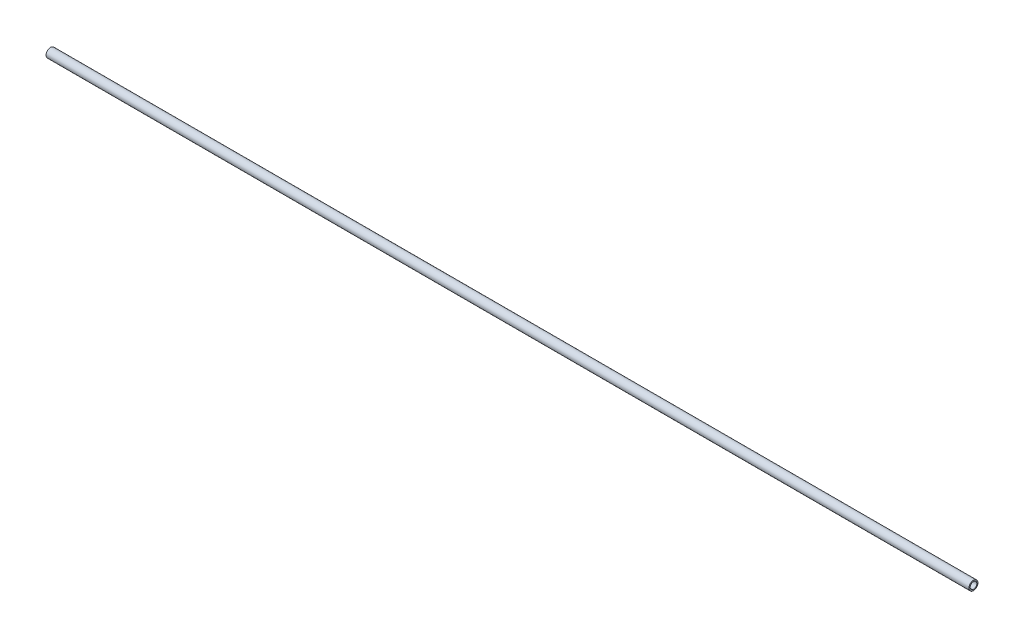
from build123d import *

# Parameters (mm, degrees)
SKETCH1_R           = 4.7625
SKETCH1_R_2         = 3.5179
BOSS_EXTRUDE1_DEPTH = 974.852


with BuildPart() as part:
    # Sketch1 → Boss-Extrude1 (new body)
    with BuildSketch(Plane(origin=(0, 0, 0), x_dir=(0, 0, -1), z_dir=(1, 0, 0))):
        Circle(SKETCH1_R)
        Circle(SKETCH1_R_2, mode=Mode.SUBTRACT)
    extrude(amount=BOSS_EXTRUDE1_DEPTH)


solid = part.part
